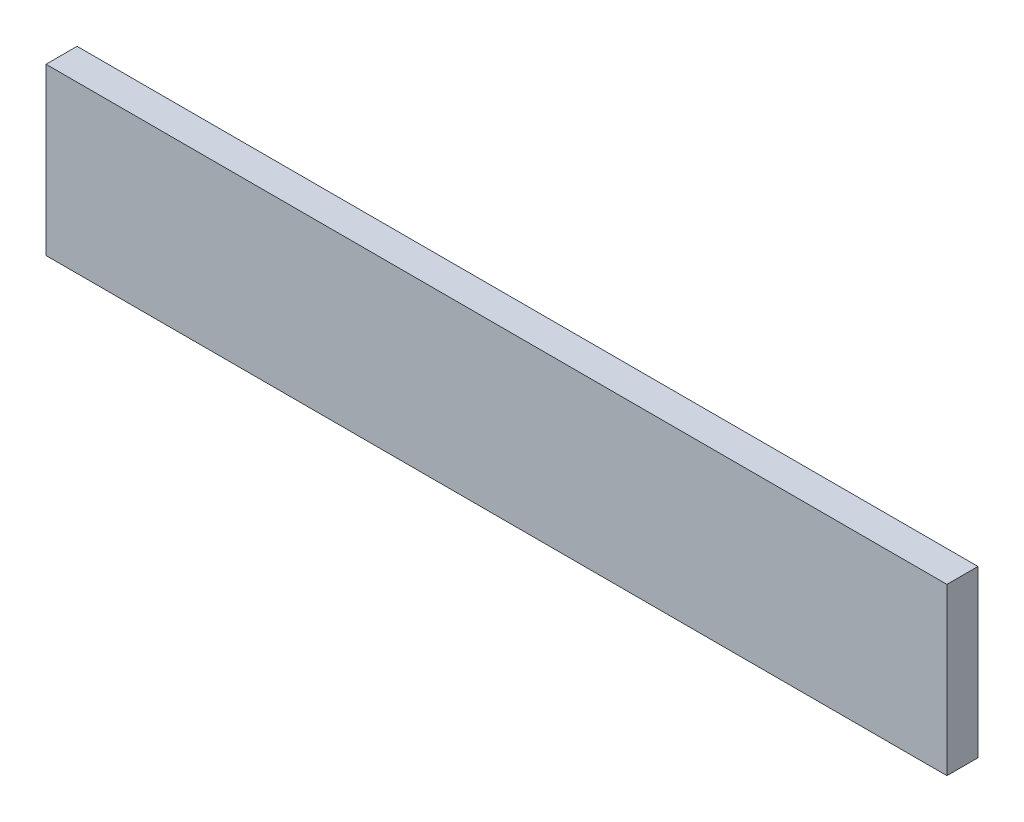
from build123d import *

# Parameters (mm, degrees)
SKETCH1_W           = 552.45
SKETCH1_H           = 101.6
BOSS_EXTRUDE1_DEPTH = 19.05


with BuildPart() as part:
    # Sketch1 → Boss-Extrude1 (new body)
    with BuildSketch(Plane.XY):
        Rectangle(SKETCH1_W, SKETCH1_H)
    extrude(amount=BOSS_EXTRUDE1_DEPTH)


solid = part.part
